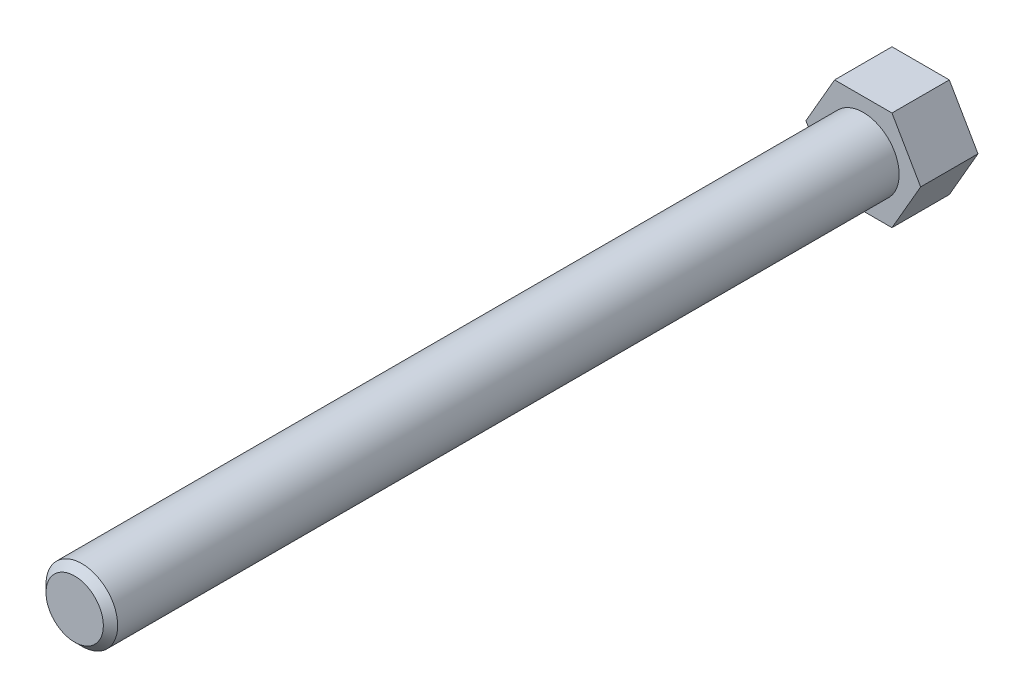
from build123d import *

# Parameters (mm, degrees)
SKETCH_1_R      = 2.5
EXTRUDE_1_DEPTH = 55
EXTRUDE_2_DEPTH = 4
CHAMFER_1_SIZE  = 0.5


with BuildPart() as part:
    # 草图1 → 拉伸1 (new body)
    with BuildSketch(Plane.XY):
        Circle(SKETCH_1_R)
    extrude(amount=EXTRUDE_1_DEPTH)

    # 草图2 → 拉伸2 (add)
    with BuildSketch(Plane.XY):
        Polygon((2, -3.464101615), (4, 0), (2, 3.464101615), (-2, 3.464101615), (-4, 0), (-2, -3.464101615), align=None)
    extrude(amount=-EXTRUDE_2_DEPTH)

    # 倒角1
    chamfer_1_edges = [part.edges().sort_by_distance(p)[0] for p in [
        (-2.5, 0, 55),
    ]]
    chamfer(chamfer_1_edges, length=CHAMFER_1_SIZE)


solid = part.part
